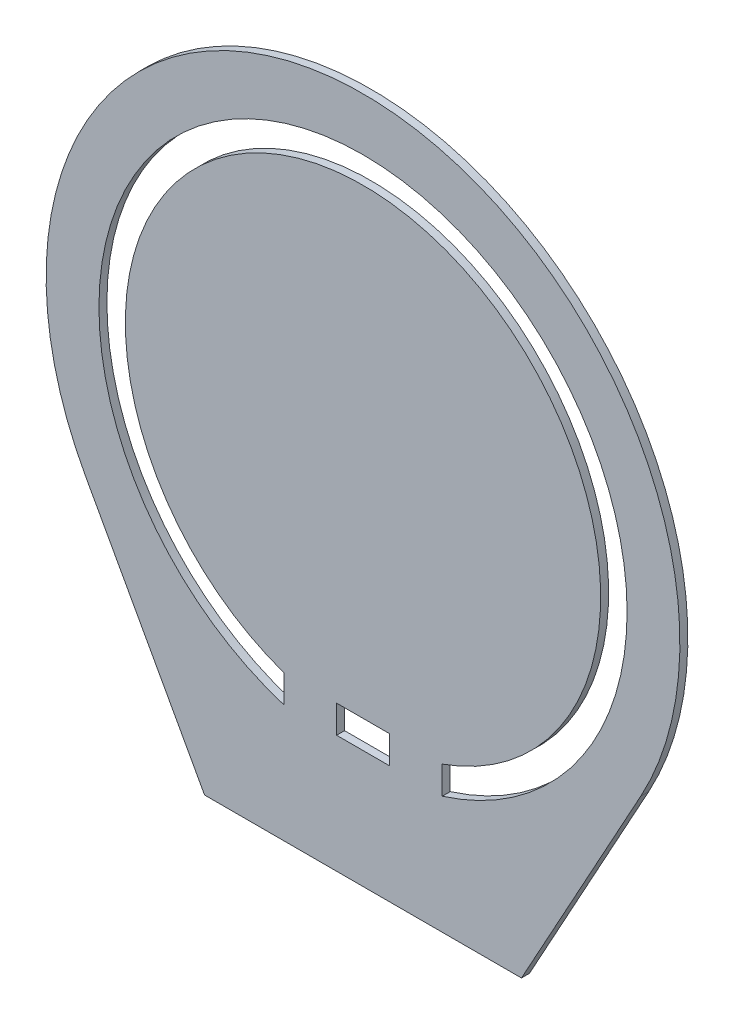
from build123d import *

# Parameters (mm, degrees)
BOSS_EXTRUDE1_DEPTH = 0.75438


with BuildPart() as part:
    # Sketch1 → Boss-Extrude1 (new body)
    with BuildSketch(Plane.XY):
        with BuildLine():
            Line((-26.292884648, -14.44590658), (-15, -35))
            Line((-15, -35), (-7.5, -35))
            Line((-7.5, -35), (15, -35))
            Line((15, -35), (26.292884648, -14.44590658))
            ThreePointArc((26.292884648, -14.44590658), (0, 30), (-26.292884648, -14.44590658))
        make_face()
        Polygon((2.5, -23.848480035), (-2.5, -23.848480035), (-2.5, -22.360679775), (-2.5, -21.213203436), (2.5, -21.213203436), (2.5, -22.360679775), align=None, mode=Mode.SUBTRACT)
        with BuildLine():
            Line((-7.5, -21.213203436), (-7.5, -23.848480035))
            ThreePointArc((-7.5, -23.848480035), (0, 25), (7.5, -23.848480035))
            Line((7.5, -23.848480035), (7.5, -21.213203436))
            ThreePointArc((7.5, -21.213203436), (0, 22.5), (-7.5, -21.213203436))
        make_face(mode=Mode.SUBTRACT)
    extrude(amount=BOSS_EXTRUDE1_DEPTH)


solid = part.part
